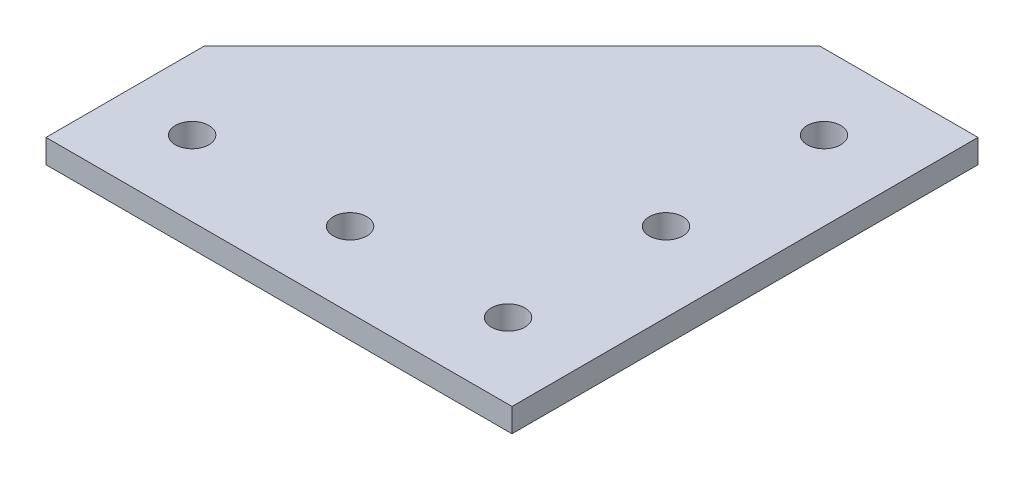
from build123d import *

# Parameters (mm, degrees)
SKETCH_1_R      = 4.25
EXTRUDE_1_DEPTH = 6


with BuildPart() as part:
    # 草图1 → 凸台-拉伸1 (new body)
    with BuildSketch(Plane(origin=(0, 0, 0), x_dir=(1, 0, 0), z_dir=(0, 1, 0))):
        Polygon((28.188290634, 27.642710816), (146.188290634, 27.642710816), (146.188290634, 145.642710816), (106.188290634, 145.642710816), (28.188290634, 67.642710816), align=None)
        with Locations(Location((126.188290634, 126.642710816, 0), (0, 0, 270))):
            Circle(SKETCH_1_R, mode=Mode.SUBTRACT)
        with Locations(Location((126.188290634, 86.642710816, 0), (0, 0, 270))):
            Circle(SKETCH_1_R, mode=Mode.SUBTRACT)
        with Locations(Location((126.188290634, 46.642710816, 0), (0, 0, 270))):
            Circle(SKETCH_1_R, mode=Mode.SUBTRACT)
        with Locations(Location((86.188290634, 46.642710816, 0), (0, 0, 270))):
            Circle(SKETCH_1_R, mode=Mode.SUBTRACT)
        with Locations(Location((46.188290634, 46.642710816, 0), (0, 0, 270))):
            Circle(SKETCH_1_R, mode=Mode.SUBTRACT)
    extrude(amount=EXTRUDE_1_DEPTH)


solid = part.part
